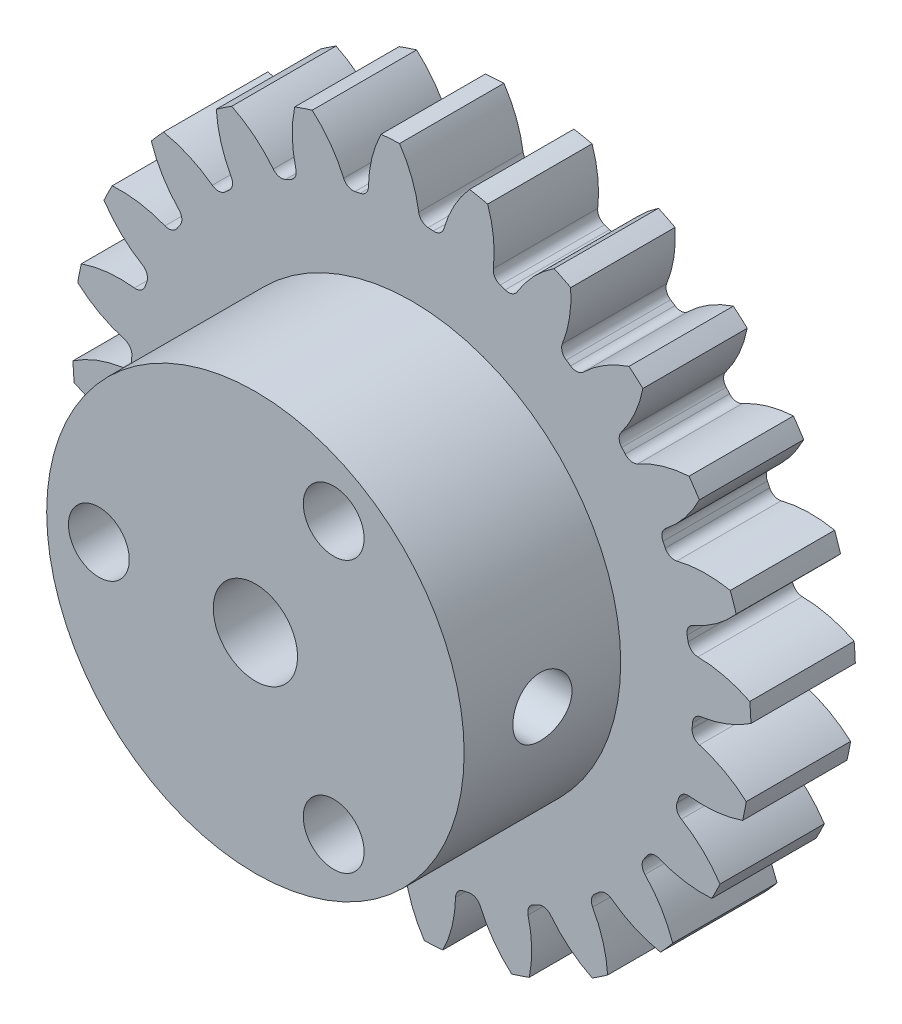
from build123d import *

# Parameters (mm, degrees)
SKETCH3_R           = 20.6375
GEARBODY_DEPTH      = 6.35
TOOTHCUT_DEPTH      = 30.868634259
CIRPATTERN1_COUNT   = 24
HUB2DIA_R           = 12.7
BOSS_EXTRUDE1_DEPTH = 9.525
SKETCH4_R           = 1.849999983
CUT_EXTRUDE1_DEPTH  = 34.206692975
SKETCH5_R           = 2.563499953
CUT_EXTRUDE2_DEPTH  = 34.206692975
SKETCH6_R           = 1.799999956
CUT_EXTRUDE3_DEPTH  = 34.206692975


with BuildPart() as part:
    # Sketch3 → gearBody (new body)
    with BuildSketch(Plane.XY):
        Circle(SKETCH3_R)
    extrude(amount=GEARBODY_DEPTH)

    # Sketch2 → toothCut (cut, through all)
    with BuildSketch(Plane.XY):
        with BuildLine():
            ThreePointArc((17.04439181, -1.303986765), (17.05590718, -1.14354882), (17.065912391, -0.983009622))
            ThreePointArc((17.065912391, -0.983009622), (17.226475942, -0.603092534), (17.591114308, -0.410332293))
            ThreePointArc((17.591114308, -0.410332293), (20.42378314, 0.626979823), (22.599606758, 2.716434472))
            ThreePointArc((22.599606758, 2.716434472), (22.711286815, -1.522725526), (22.034703624, -5.709034773))
            ThreePointArc((22.034703624, -5.709034773), (20.157284273, -3.347822008), (17.488443939, -1.941649751))
            ThreePointArc((17.488443939, -1.941649751), (17.152801577, -1.701937731), (17.04439181, -1.303986765))
        make_face()
    toothcut = extrude(amount=TOOTHCUT_DEPTH, mode=Mode.SUBTRACT)

    # CirPattern1: toothCut ×24 about axis
    cirpattern1_axis = Axis((0, 0, 0), (0, 0, 1))
    for i in range(1, CIRPATTERN1_COUNT):
        add(toothcut.rotate(cirpattern1_axis, i * 360 / CIRPATTERN1_COUNT), mode=Mode.SUBTRACT)

    # hub2Dia → Boss-Extrude1 (add)
    with BuildSketch(Plane.XY.offset(6.35)):
        with Locations(Location((0, 0, 0), (0, 0, 180))):
            Circle(HUB2DIA_R)
    extrude(amount=BOSS_EXTRUDE1_DEPTH)

    # Sketch4 → Cut-Extrude1 (cut, through all)
    with BuildSketch(Plane(origin=(0, 0, 0), x_dir=(-1, 0, 0), z_dir=(0, 0, -1))):
        with Locations((9.525, 0)):
            Circle(SKETCH4_R)
        with Locations((-4.7625, -8.248891971)):
            Circle(SKETCH4_R)
        with Locations((-4.7625, 8.248891971)):
            Circle(SKETCH4_R)
    extrude(amount=-CUT_EXTRUDE1_DEPTH, mode=Mode.SUBTRACT)

    # Sketch5 → Cut-Extrude2 (cut, through all)
    with BuildSketch(Plane(origin=(0, 0, 0), x_dir=(-1, 0, 0), z_dir=(0, 0, -1))):
        Circle(SKETCH5_R)
    extrude(amount=-CUT_EXTRUDE2_DEPTH, mode=Mode.SUBTRACT)

    # Sketch6 → Cut-Extrude3 (cut, through all)
    with BuildSketch(Plane(origin=(0, 0, 0), x_dir=(0, 0, -1), z_dir=(1, 0, 0))):
        with Locations(Location((-11.1125, 0, 0), (0, 0, 180))):
            Circle(SKETCH6_R)
    extrude(amount=CUT_EXTRUDE3_DEPTH, mode=Mode.SUBTRACT)


solid = part.part
